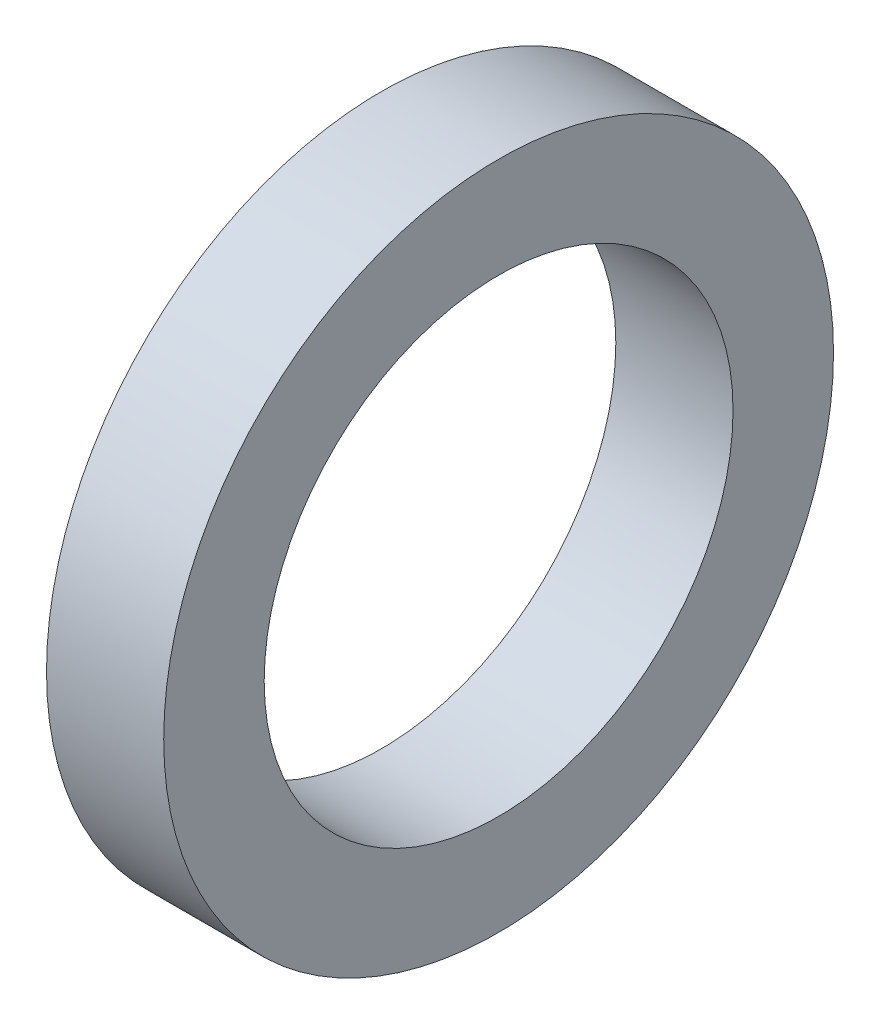
from build123d import *

# Parameters (mm, degrees)
SKETCH1_W = 3.5
SKETCH1_H = 3


with BuildPart() as part:
    # Sketch1 → Revolve1 (revolve)
    with BuildSketch(Plane.XY, mode=Mode.PRIVATE) as revolve1_sk:
        with Locations((1.75, 8.5)):
            Rectangle(SKETCH1_W, SKETCH1_H)
    revolve(revolve1_sk.sketch.rotate(Axis((0, 0, 0), (1, 0, 0)), 90), axis=Axis((0, 0, 0), (1, 0, 0)))


solid = part.part
